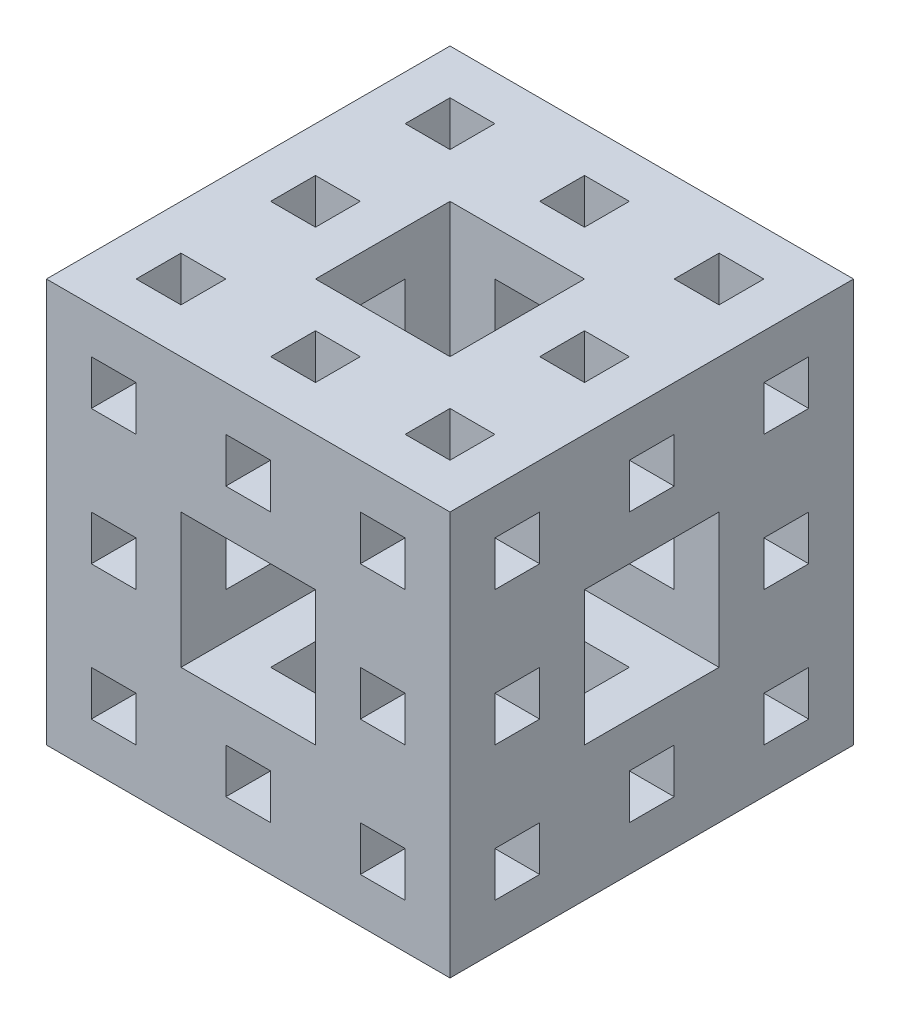
from build123d import *

# Parameters (mm, degrees)
SKETCH_1_W          = 81
SKETCH_1_H          = 81
EXTRUDE_1_DEPTH     = 81
SKETCH_2_W          = 27
SKETCH_2_H          = 27
CUT_EXTRUDE_1_DEPTH = 141.296115413
SKETCH_3_W          = 27
SKETCH_3_H          = 27
CUT_EXTRUDE_2_DEPTH = 141.296115413
SKETCH_4_W          = 27
SKETCH_4_H          = 27
CUT_EXTRUDE_3_DEPTH = 141.296115413
SKETCH_5_W          = 9
SKETCH_5_H          = 9
CUT_EXTRUDE_4_DEPTH = 141.296115413
SKETCH_6_W          = 9
SKETCH_6_H          = 9
CUT_EXTRUDE_5_DEPTH = 141.296115413
SKETCH_7_W          = 9
SKETCH_7_H          = 9
CUT_EXTRUDE_6_DEPTH = 141.296115413


with BuildPart() as part:
    # 草图1 → 凸台-拉伸1 (new body)
    with BuildSketch(Plane.XY):
        with Locations((40.5, 40.5)):
            Rectangle(SKETCH_1_W, SKETCH_1_H)
    extrude(amount=EXTRUDE_1_DEPTH)

    # 草图2 → 切除-拉伸1 (cut, through all)
    with BuildSketch(Plane(origin=(0, 0, 0), x_dir=(0, 0, -1), z_dir=(1, 0, 0))):
        with Locations((-40.5, 40.5)):
            Rectangle(SKETCH_2_W, SKETCH_2_H)
    extrude(amount=CUT_EXTRUDE_1_DEPTH, mode=Mode.SUBTRACT)

    # 草图3 → 切除-拉伸2 (cut, through all)
    with BuildSketch(Plane(origin=(0, 0, 0), x_dir=(1, 0, 0), z_dir=(0, 1, 0))):
        with Locations((40.5, -40.5)):
            Rectangle(SKETCH_3_W, SKETCH_3_H)
    extrude(amount=CUT_EXTRUDE_2_DEPTH, mode=Mode.SUBTRACT)

    # 草图4 → 切除-拉伸3 (cut, through all)
    with BuildSketch(Plane.XY):
        with Locations((40.5, 40.5)):
            Rectangle(SKETCH_4_W, SKETCH_4_H)
    extrude(amount=CUT_EXTRUDE_3_DEPTH, mode=Mode.SUBTRACT)

    # 草图5 → 切除-拉伸4 (cut, through all)
    with BuildSketch(Plane(origin=(0, 0, 0), x_dir=(0, 0, -1), z_dir=(1, 0, 0))):
        with Locations((-13.5, 13.5)):
            Rectangle(SKETCH_5_W, SKETCH_5_H)
        with Locations((-40.5, 13.5)):
            Rectangle(SKETCH_5_W, SKETCH_5_H)
        with Locations((-67.5, 13.5)):
            Rectangle(SKETCH_5_W, SKETCH_5_H)
        with Locations((-13.5, 40.5)):
            Rectangle(SKETCH_5_W, SKETCH_5_H)
        with Locations((-67.5, 40.5)):
            Rectangle(SKETCH_5_W, SKETCH_5_H)
        with Locations((-13.5, 67.5)):
            Rectangle(SKETCH_5_W, SKETCH_5_H)
        with Locations((-40.5, 67.5)):
            Rectangle(SKETCH_5_W, SKETCH_5_H)
        with Locations((-67.5, 67.5)):
            Rectangle(SKETCH_5_W, SKETCH_5_H)
    extrude(amount=CUT_EXTRUDE_4_DEPTH, mode=Mode.SUBTRACT)

    # 草图6 → 切除-拉伸5 (cut, through all)
    with BuildSketch(Plane(origin=(0, 0, 0), x_dir=(1, 0, 0), z_dir=(0, 1, 0))):
        with Locations((13.5, -13.5)):
            Rectangle(SKETCH_6_W, SKETCH_6_H)
        with Locations((40.5, -13.5)):
            Rectangle(SKETCH_6_W, SKETCH_6_H)
        with Locations((67.5, -13.5)):
            Rectangle(SKETCH_6_W, SKETCH_6_H)
        with Locations((13.5, -40.5)):
            Rectangle(SKETCH_6_W, SKETCH_6_H)
        with Locations((67.5, -40.5)):
            Rectangle(SKETCH_6_W, SKETCH_6_H)
        with Locations((13.5, -67.5)):
            Rectangle(SKETCH_6_W, SKETCH_6_H)
        with Locations((40.5, -67.5)):
            Rectangle(SKETCH_6_W, SKETCH_6_H)
        with Locations((67.5, -67.5)):
            Rectangle(SKETCH_6_W, SKETCH_6_H)
    extrude(amount=CUT_EXTRUDE_5_DEPTH, mode=Mode.SUBTRACT)

    # 草图7 → 切除-拉伸6 (cut, through all)
    with BuildSketch(Plane.XY):
        with Locations((13.5, 13.5)):
            Rectangle(SKETCH_7_W, SKETCH_7_H)
        with Locations((40.5, 13.5)):
            Rectangle(SKETCH_7_W, SKETCH_7_H)
        with Locations((67.5, 13.5)):
            Rectangle(SKETCH_7_W, SKETCH_7_H)
        with Locations((13.5, 40.5)):
            Rectangle(SKETCH_7_W, SKETCH_7_H)
        with Locations((67.5, 40.5)):
            Rectangle(SKETCH_7_W, SKETCH_7_H)
        with Locations((13.5, 67.5)):
            Rectangle(SKETCH_7_W, SKETCH_7_H)
        with Locations((40.5, 67.5)):
            Rectangle(SKETCH_7_W, SKETCH_7_H)
        with Locations((67.5, 67.5)):
            Rectangle(SKETCH_7_W, SKETCH_7_H)
    extrude(amount=CUT_EXTRUDE_6_DEPTH, mode=Mode.SUBTRACT)


solid = part.part
